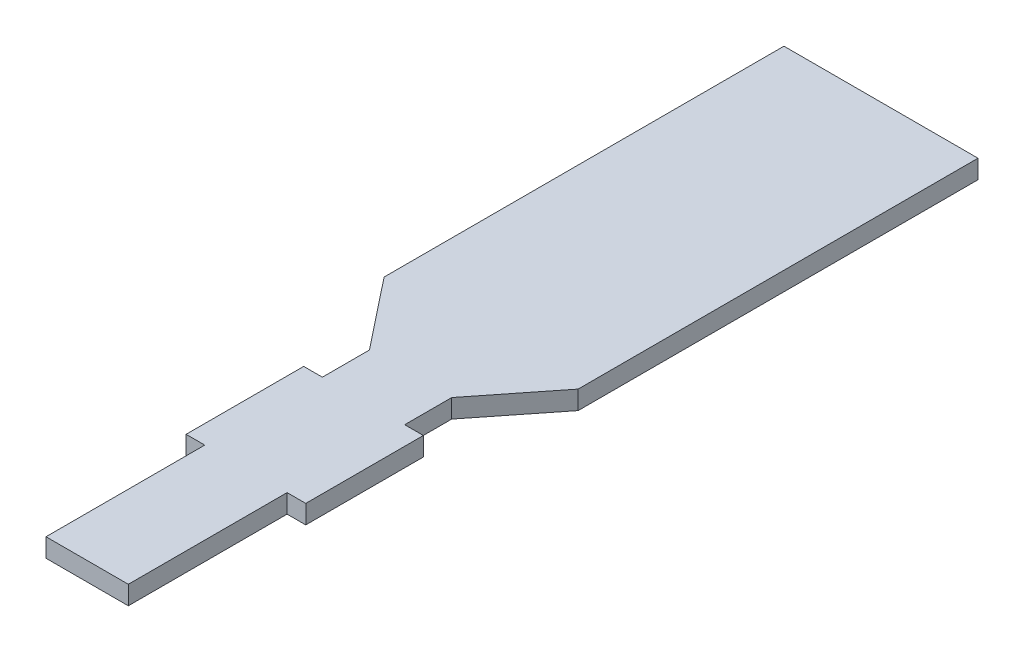
from build123d import *

# Parameters (mm, degrees)
BOSS_EXTRUDE1_DEPTH = 3.175


with BuildPart() as part:
    # Sketch1 → Boss-Extrude1 (new body)
    with BuildSketch(Plane(origin=(0, 0, 0), x_dir=(1, 0, 0), z_dir=(0, 1, 0))):
        Polygon((-16.5, 0), (16.5, 0), (16.5, -68), (7, -80), (7, -88), (10.175, -88), (10.175, -108), (7, -108), (7, -135), (-7, -135), (-7, -108), (-10.175, -108), (-10.175, -88), (-7, -88), (-7, -80), (-16.5, -68), align=None)
    extrude(amount=BOSS_EXTRUDE1_DEPTH)


solid = part.part
